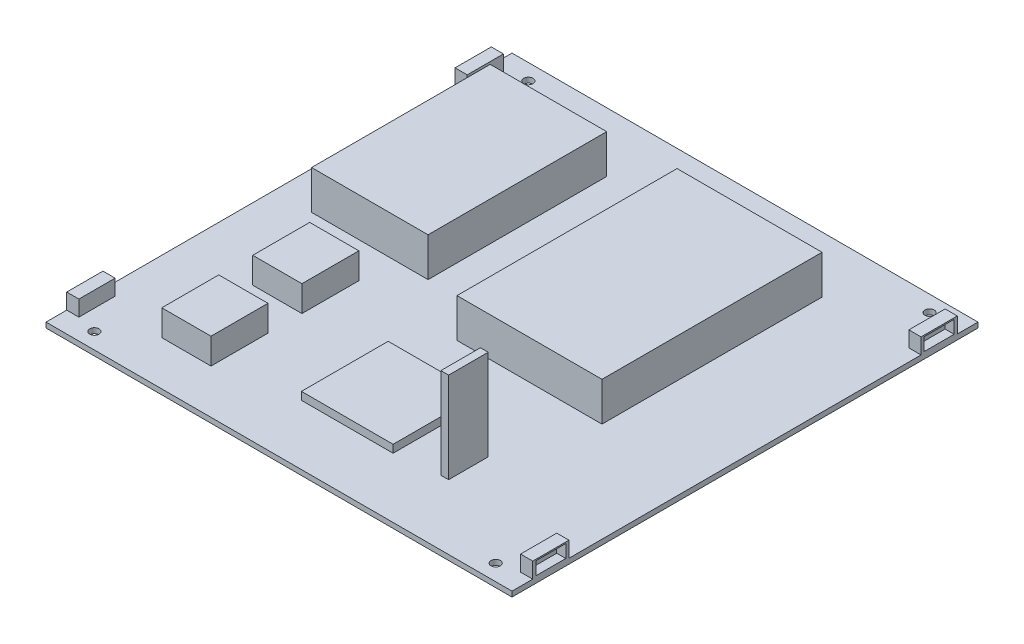
from build123d import *

# Parameters (mm, degrees)
SKETCH_1_W                                 = 180
SKETCH_1_H                                 = 180
EXTRUDE_1_DEPTH                            = 2
SKETCH_2_W                                 = 4.7
SKETCH_2_H                                 = 14
EXTRUDE_2_DEPTH                            = 6.05
SKETCH_3_W                                 = 11.570247934
SKETCH_3_H                                 = 5
CUT_EXTRUDE_1_DEPTH                        = 3.5
MIRROR_1_AT_THE_SECOND_PLANE_COPY_1_SKET_W = 11.570247934
MIRROR_1_AT_THE_SECOND_PLANE_COPY_1_SKET_H = 5
MIRROR_1_AT_THE_SECOND_PLANE_COPY_1_DEPTH  = 3.5
SKETCH_4_W                                 = 45
SKETCH_4_H                                 = 69
EXTRUDE_3_DEPTH                            = 15
SKETCH_5_W                                 = 19
SKETCH_5_H                                 = 22
EXTRUDE_4_DEPTH                            = 10
SKETCH_6_W                                 = 56
SKETCH_6_H                                 = 85
EXTRUDE_5_DEPTH                            = 15
SKETCH_7_W                                 = 35.4
SKETCH_7_H                                 = 33.5
EXTRUDE_6_DEPTH                            = 10
SKETCH_8_W                                 = 35.4
SKETCH_8_H                                 = 7
CUT_EXTRUDE_6_DEPTH                        = 30
SKETCH_9_W                                 = 3
SKETCH_9_H                                 = 15.3
EXTRUDE_7_DEPTH                            = 35
SKETCH_10_R                                = 1.8
CUT_EXTRUDE_7_DEPTH                        = 10
MIRROR_3_AT_THE_SECOND_PLANE_COPY_1_SKET_R = 1.8
MIRROR_3_AT_THE_SECOND_PLANE_COPY_1_DEPTH  = 10


with BuildPart() as part:
    # 草图1 → 凸台-拉伸1 (new body)
    with BuildSketch(Plane(origin=(0, 0, 0), x_dir=(1, 0, 0), z_dir=(0, 1, 0))):
        Rectangle(SKETCH_1_W, SKETCH_1_H)
    extrude(amount=EXTRUDE_1_DEPTH)

    # 草图2 → 凸台-拉伸2 (add)
    with BuildSketch(Plane(origin=(0, 2, 0), x_dir=(1, 0, 0), z_dir=(0, 1, 0))):
        with Locations((-87.65, 75)):
            Rectangle(SKETCH_2_W, SKETCH_2_H)
        with Locations((-87.65, -75)):
            Rectangle(SKETCH_2_W, SKETCH_2_H)
        with Locations((87.65, -75)):
            Rectangle(SKETCH_2_W, SKETCH_2_H)
        with Locations((87.65, 75)):
            Rectangle(SKETCH_2_W, SKETCH_2_H)
    extrude(amount=EXTRUDE_2_DEPTH)

    # 草图3 → 切除-拉伸1 (cut)
    with BuildSketch(Plane.ZY.offset(90)):
        with Locations((-75, 5.025)):
            Rectangle(SKETCH_3_W, SKETCH_3_H)
    cut_extrude_1 = extrude(amount=-CUT_EXTRUDE_1_DEPTH, mode=Mode.SUBTRACT)

    # 镜向1: 切除-拉伸1 across plane
    add(cut_extrude_1.mirror(Plane(origin=(0, 0, 0), x_dir=(0, 0, 1), z_dir=(1, 0, 0))), mode=Mode.SUBTRACT)

    # 镜向1 at the second plane: 切除-拉伸1 across plane
    add(cut_extrude_1.mirror(Plane.XY), mode=Mode.SUBTRACT)

    # 镜向1 at the second plane copy 1 sket → 镜向1 at the second plane copy 1 (cut)
    with BuildSketch(Plane(origin=(90, 0, 0), x_dir=(0, 0, -1), z_dir=(1, 0, 0))):
        with Locations((-75, 5.025)):
            Rectangle(MIRROR_1_AT_THE_SECOND_PLANE_COPY_1_SKET_W, MIRROR_1_AT_THE_SECOND_PLANE_COPY_1_SKET_H)
    extrude(amount=-MIRROR_1_AT_THE_SECOND_PLANE_COPY_1_DEPTH, mode=Mode.SUBTRACT)

    # 草图4 → 凸台-拉伸3 (add)
    with BuildSketch(Plane(origin=(0, 2, 0), x_dir=(1, 0, 0), z_dir=(0, 1, 0))):
        with Locations((-52.915832737, 32.492177997)):
            Rectangle(SKETCH_4_W, SKETCH_4_H)
    extrude(amount=EXTRUDE_3_DEPTH)

    # 草图5 → 凸台-拉伸4 (add)
    with BuildSketch(Plane(origin=(0, 2, 0), x_dir=(1, 0, 0), z_dir=(0, 1, 0))):
        with Locations((-52.915832737, -26.729978553)):
            Rectangle(SKETCH_5_W, SKETCH_5_H)
        with Locations((-52.915832737, -61.854870093)):
            Rectangle(SKETCH_5_W, SKETCH_5_H)
    extrude(amount=EXTRUDE_4_DEPTH)

    # 草图6 → 凸台-拉伸5 (add)
    with BuildSketch(Plane(origin=(0, 2, 0), x_dir=(1, 0, 0), z_dir=(0, 1, 0))):
        with Locations((23.523310823, 25.733573793)):
            Rectangle(SKETCH_6_W, SKETCH_6_H)
    extrude(amount=EXTRUDE_5_DEPTH)

    # 草图7 → 凸台-拉伸6 (add)
    with BuildSketch(Plane(origin=(0, 2, 0), x_dir=(1, 0, 0), z_dir=(0, 1, 0))):
        with Locations((10.21182737, -57.09339848)):
            Rectangle(SKETCH_7_W, SKETCH_7_H)
    extrude(amount=EXTRUDE_6_DEPTH)

    # 草图8 → 切除-拉伸6 (cut)
    with BuildSketch(Plane.XY.offset(73.84339848)):
        with Locations((10.21182737, 5.5)):
            Rectangle(SKETCH_8_W, SKETCH_8_H)
    extrude(amount=-CUT_EXTRUDE_6_DEPTH, mode=Mode.SUBTRACT)

    # 草图9 → 凸台-拉伸7 (add)
    with BuildSketch(Plane(origin=(0, 2, 0), x_dir=(1, 0, 0), z_dir=(0, 1, 0))):
        with Locations((38.990613596, -57.325485465)):
            Rectangle(SKETCH_9_W, SKETCH_9_H)
    extrude(amount=EXTRUDE_7_DEPTH)

    # 草图10 → 切除-拉伸7 (cut)
    with BuildSketch(Plane(origin=(0, 2, 0), x_dir=(1, 0, 0), z_dir=(0, 1, 0))):
        with Locations(Location((77.5, 83.802246308, 0), (0, 0, 270))):
            Circle(SKETCH_10_R)
    cut_extrude_7 = extrude(amount=-CUT_EXTRUDE_7_DEPTH, mode=Mode.SUBTRACT)

    # 镜向3: 切除-拉伸7 across plane
    add(cut_extrude_7.mirror(Plane(origin=(0, 0, 0), x_dir=(0, 0, 1), z_dir=(1, 0, 0))), mode=Mode.SUBTRACT)

    # 镜向3 at the second plane: 切除-拉伸7 across plane
    add(cut_extrude_7.mirror(Plane.XY), mode=Mode.SUBTRACT)

    # 镜向3 at the second plane copy 1 sket → 镜向3 at the second plane copy 1 (cut)
    with BuildSketch(Plane(origin=(0, 2, 0), x_dir=(-1, 0, 0), z_dir=(0, 1, 0))):
        with Locations(Location((77.5, 83.802246308, 0), (0, 0, 270))):
            Circle(MIRROR_3_AT_THE_SECOND_PLANE_COPY_1_SKET_R)
    extrude(amount=-MIRROR_3_AT_THE_SECOND_PLANE_COPY_1_DEPTH, mode=Mode.SUBTRACT)


solid = part.part
